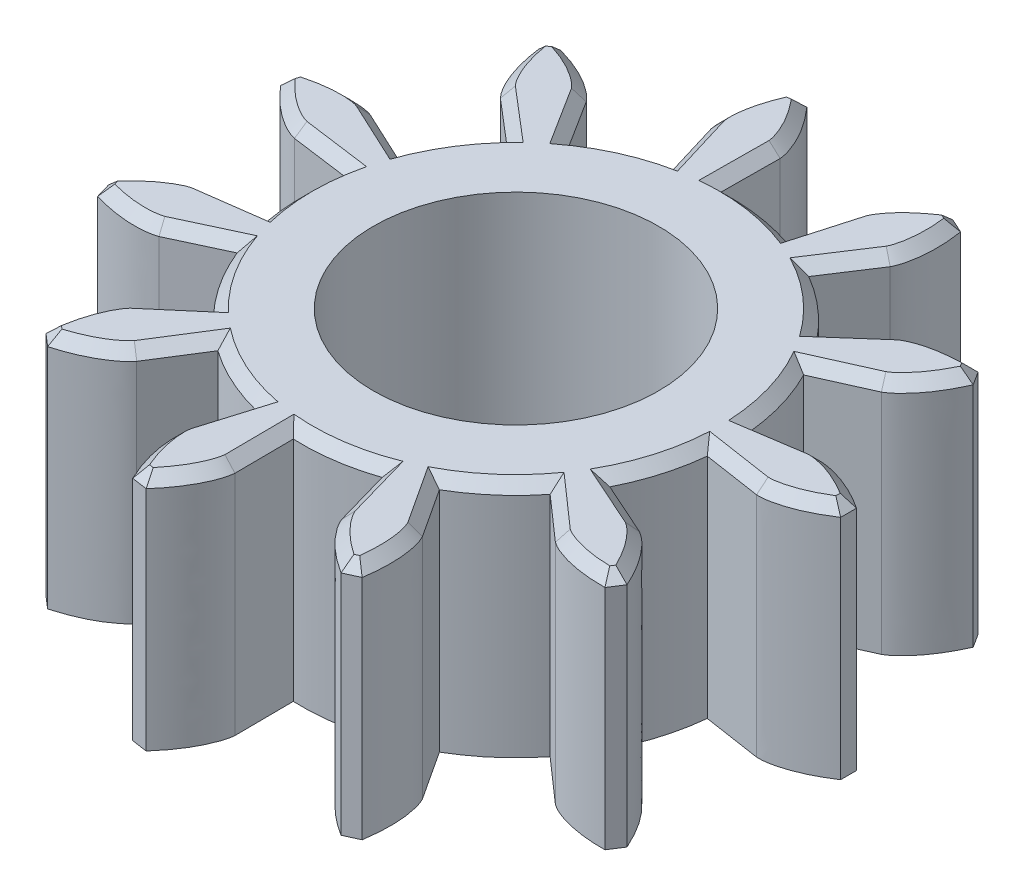
from build123d import *

# Parameters (mm, degrees)
BOSS_EXTRUDE1_DEPTH = 4.5
SKETCH2_R           = 2.7
CUT_EXTRUDE1_DEPTH  = 11.20953302
CHAMFER1_SIZE       = 0.2


with BuildPart() as part:
    # Sketch1 → Boss-Extrude1 (new body)
    with BuildSketch(Plane.XZ.offset(5)):
        with BuildLine():
            Line((3.190229537, -2.808012732), (3.879551376, -3.414747915))
            add(Edge.make_bspline(
                [(3.879551376, -3.414747915), (4.371081204, -3.768547035), (5.325327031, -3.7270487)],
                knots=[3.664389894, 3.664389894, 3.664389894, 4.719659584, 4.719659584, 4.719659584], degree=2, weights=[1, 0.864000321, 1]))
            Line((5.325327031, -3.7270487), (5.602463544, -3.295815869))
            add(Edge.make_bspline(
                [(5.602463544, -3.295815869), (5.243842932, -2.409552511), (4.717787845, -2.11042651)],
                knots=[1.542822379, 1.542822379, 1.542822379, 2.616695251, 2.616695251, 2.616695251], degree=2, weights=[1, 0.859279742, 1]))
            Line((4.717787845, -2.11042651), (3.879527469, -1.735444214))
            ThreePointArc((3.879527469, -1.735444214), (4.077845138, -1.197363367), (4.201918167, -0.637482326))
            Line((4.201918167, -0.637482326), (5.109838405, -0.775224919))
            add(Edge.make_bspline(
                [(5.109838405, -0.775224919), (5.714617855, -0.807118591), (6.494944834, -0.256303727)],
                knots=[3.664389894, 3.664389894, 3.664389894, 4.719659584, 4.719659584, 4.719659584], degree=2, weights=[1, 0.864000321, 1]))
            Line((6.494944834, -0.256303727), (6.494944834, 0.256303727))
            add(Edge.make_bspline(
                [(6.494944834, 0.256303727), (5.714103832, 0.807990967), (5.109838405, 0.775224919)],
                knots=[1.542822379, 1.542822379, 1.542822379, 2.616695251, 2.616695251, 2.616695251], degree=2, weights=[1, 0.859279742, 1]))
            Line((5.109838405, 0.775224919), (4.201918167, 0.637482326))
            ThreePointArc((4.201918167, 0.637482326), (4.077845138, 1.197363367), (3.879527469, 1.735444214))
            Line((3.879527469, 1.735444214), (4.717787845, 2.11042651))
            add(Edge.make_bspline(
                [(4.717787845, 2.11042651), (5.243803714, 2.410564302), (5.602463544, 3.295815869)],
                knots=[0.52279724, 0.52279724, 0.52279724, 1.57806693, 1.57806693, 1.57806693], degree=2, weights=[1, 0.864000321, 1]))
            Line((5.602463544, 3.295815869), (5.325327031, 3.7270487))
            add(Edge.make_bspline(
                [(5.325327031, 3.7270487), (4.370177139, 3.769003022), (3.879551376, 3.414747915)],
                knots=[1.542822379, 1.542822379, 1.542822379, 2.616695251, 2.616695251, 2.616695251], degree=2, weights=[1, 0.859279742, 1]))
            Line((3.879551376, 3.414747915), (3.190229537, 2.808012732))
            ThreePointArc((3.190229537, 2.808012732), (2.783158119, 3.211935691), (2.32541421, 3.557379478))
            Line((2.32541421, 3.557379478), (2.827872978, 4.326032434))
            add(Edge.make_bspline(
                [(2.827872978, 4.326032434), (3.108118945, 4.862910062), (2.931239663, 5.801537213)],
                knots=[0.52279724, 0.52279724, 0.52279724, 1.57806693, 1.57806693, 1.57806693], degree=2, weights=[1, 0.864000321, 1]))
            Line((2.931239663, 5.801537213), (2.464955522, 6.014482045))
            add(Edge.make_bspline(
                [(2.464955522, 6.014482045), (1.638750082, 5.533383248), (1.417534197, 4.970112574)],
                knots=[1.542822379, 1.542822379, 1.542822379, 2.616695251, 2.616695251, 2.616695251], degree=2, weights=[1, 0.859279742, 1]))
            Line((1.417534197, 4.970112574), (1.16566557, 4.087018936))
            ThreePointArc((1.16566557, 4.087018936), (0.604838063, 4.206741128), (0.032998371, 4.249871893))
            Line((0.032998371, 4.249871893), (0.040128421, 5.168153627))
            add(Edge.make_bspline(
                [(0.040128421, 5.168153627), (-0.014371628, 5.771316237), (-0.670632099, 6.465311484)],
                knots=[0.52279724, 0.52279724, 0.52279724, 1.57806693, 1.57806693, 1.57806693], degree=2, weights=[1, 0.864000321, 1]))
            Line((-0.670632099, 6.465311484), (-1.178021948, 6.392359837))
            add(Edge.make_bspline(
                [(-1.178021948, 6.392359837), (-1.612968547, 5.54095339), (-1.494540074, 4.947501609)],
                knots=[4.684415032, 4.684415032, 4.684415032, 5.758287905, 5.758287905, 5.758287905], degree=2, weights=[1, 0.859279742, 1]))
            Line((-1.494540074, 4.947501609), (-1.22898898, 4.068425505))
            ThreePointArc((-1.22898898, 4.068425505), (-1.765513805, 3.86593598), (-2.269894218, 3.59306001))
            Line((-2.269894218, 3.59306001), (-2.760356625, 4.369422559))
            add(Edge.make_bspline(
                [(-2.760356625, 4.369422559), (-3.132299311, 4.847370285), (-4.059582909, 5.076395041)],
                knots=[0.52279724, 0.52279724, 0.52279724, 1.57806693, 1.57806693, 1.57806693], degree=2, weights=[1, 0.864000321, 1]))
            Line((-4.059582909, 5.076395041), (-4.446985774, 4.740708547))
            add(Edge.make_bspline(
                [(-4.446985774, 4.740708547), (-4.352581058, 3.789309981), (-3.932108431, 3.35409384)],
                knots=[4.684415032, 4.684415032, 4.684415032, 5.758287905, 5.758287905, 5.758287905], degree=2, weights=[1, 0.859279742, 1]))
            Line((-3.932108431, 3.35409384), (-3.233448212, 2.758135722))
            ThreePointArc((-3.233448212, 2.758135722), (-3.575327515, 2.297723474), (-3.852111431, 1.795476962))
            Line((-3.852111431, 1.795476962), (-4.684447947, 2.183430702))
            add(Edge.make_bspline(
                [(-4.684447947, 2.183430702), (-5.255744094, 2.384418517), (-6.159644828, 2.07575904)],
                knots=[0.52279724, 0.52279724, 0.52279724, 1.57806693, 1.57806693, 1.57806693], degree=2, weights=[1, 0.864000321, 1]))
            Line((-6.159644828, 2.07575904), (-6.304063037, 1.58391579))
            add(Edge.make_bspline(
                [(-6.304063037, 1.58391579), (-5.710279838, 0.834587427), (-5.121260145, 0.695784976)],
                knots=[4.684415032, 4.684415032, 4.684415032, 5.758287905, 5.758287905, 5.758287905], degree=2, weights=[1, 0.859279742, 1]))
            Line((-5.121260145, 0.695784976), (-4.211310483, 0.572157336))
            ThreePointArc((-4.211310483, 0.572157336), (-4.25, 0), (-4.211310483, -0.572157336))
            Line((-4.211310483, -0.572157336), (-5.121260145, -0.695784976))
            add(Edge.make_bspline(
                [(-5.121260145, -0.695784976), (-5.710527263, -0.835569283), (-6.304063037, -1.58391579)],
                knots=[3.664389894, 3.664389894, 3.664389894, 4.719659584, 4.719659584, 4.719659584], degree=2, weights=[1, 0.864000321, 1]))
            Line((-6.304063037, -1.58391579), (-6.159644828, -2.07575904))
            add(Edge.make_bspline(
                [(-6.159644828, -2.07575904), (-5.255005116, -2.385110738), (-4.684447947, -2.183430702)],
                knots=[4.684415032, 4.684415032, 4.684415032, 5.758287905, 5.758287905, 5.758287905], degree=2, weights=[1, 0.859279742, 1]))
            Line((-4.684447947, -2.183430702), (-3.852111431, -1.795476962))
            ThreePointArc((-3.852111431, -1.795476962), (-3.575327515, -2.297723474), (-3.233448212, -2.758135722))
            Line((-3.233448212, -2.758135722), (-3.932108431, -3.35409384))
            add(Edge.make_bspline(
                [(-3.932108431, -3.35409384), (-4.352258375, -3.790269739), (-4.446985774, -4.740708547)],
                knots=[3.664389894, 3.664389894, 3.664389894, 4.719659584, 4.719659584, 4.719659584], degree=2, weights=[1, 0.864000321, 1]))
            Line((-4.446985774, -4.740708547), (-4.059582909, -5.076395041))
            add(Edge.make_bspline(
                [(-4.059582909, -5.076395041), (-3.1313034, -4.847553096), (-2.760356625, -4.369422559)],
                knots=[4.684415032, 4.684415032, 4.684415032, 5.758287905, 5.758287905, 5.758287905], degree=2, weights=[1, 0.859279742, 1]))
            Line((-2.760356625, -4.369422559), (-2.269894218, -3.59306001))
            ThreePointArc((-2.269894218, -3.59306001), (-1.765513805, -3.86593598), (-1.22898898, -4.068425505))
            Line((-1.22898898, -4.068425505), (-1.494540074, -4.947501609))
            add(Edge.make_bspline(
                [(-1.494540074, -4.947501609), (-1.612178204, -5.541586333), (-1.178021948, -6.392359837)],
                knots=[3.664389894, 3.664389894, 3.664389894, 4.719659584, 4.719659584, 4.719659584], degree=2, weights=[1, 0.864000321, 1]))
            Line((-1.178021948, -6.392359837), (-0.670632099, -6.465311484))
            add(Edge.make_bspline(
                [(-0.670632099, -6.465311484), (-0.013434979, -5.770931598), (0.040128421, -5.168153627)],
                knots=[1.542822379, 1.542822379, 1.542822379, 2.616695251, 2.616695251, 2.616695251], degree=2, weights=[1, 0.859279742, 1]))
            Line((0.040128421, -5.168153627), (0.032998371, -4.249871893))
            ThreePointArc((0.032998371, -4.249871893), (0.604838063, -4.206741128), (1.16566557, -4.087018936))
            Line((1.16566557, -4.087018936), (1.417534197, -4.970112574))
            add(Edge.make_bspline(
                [(1.417534197, -4.970112574), (1.639757156, -5.533488422), (2.464955522, -6.014482045)],
                knots=[3.664389894, 3.664389894, 3.664389894, 4.719659584, 4.719659584, 4.719659584], degree=2, weights=[1, 0.864000321, 1]))
            Line((2.464955522, -6.014482045), (2.931239663, -5.801537213))
            add(Edge.make_bspline(
                [(2.931239663, -5.801537213), (3.108698953, -4.862080092), (2.827872978, -4.326032434)],
                knots=[1.542822379, 1.542822379, 1.542822379, 2.616695251, 2.616695251, 2.616695251], degree=2, weights=[1, 0.859279742, 1]))
            Line((2.827872978, -4.326032434), (2.32541421, -3.557379478))
            ThreePointArc((2.32541421, -3.557379478), (2.783158119, -3.211935691), (3.190229537, -2.808012732))
        make_face()
    extrude(amount=-BOSS_EXTRUDE1_DEPTH)

    # Sketch2 → Cut-Extrude1 (cut, through all)
    # profile 1 of 2: a face of its own
    with BuildSketch(Plane(origin=(0, -0.5, 0), x_dir=(1, 0, 0), z_dir=(0, 1, 0))):
        with BuildLine():
            Line((2.32541421, 3.557379478), (2.827872978, 4.326032434))
            add(Edge.make_bspline(
                [(2.827872978, 4.326032434), (3.108698953, 4.862080092), (2.931239663, 5.801537213)],
                knots=[3.666490056, 3.666490056, 3.666490056, 4.740362929, 4.740362929, 4.740362929], degree=2, weights=[1, 0.859279742, 1]))
            Line((2.931239663, 5.801537213), (2.464955522, 6.014482045))
            add(Edge.make_bspline(
                [(2.464955522, 6.014482045), (1.639757156, 5.533488422), (1.417534197, 4.970112574)],
                knots=[1.563525724, 1.563525724, 1.563525724, 2.618795414, 2.618795414, 2.618795414], degree=2, weights=[1, 0.864000321, 1]))
            Line((1.417534197, 4.970112574), (1.16566557, 4.087018936))
            ThreePointArc((1.16566557, 4.087018936), (0.604838063, 4.206741128), (0.032998371, 4.249871893))
            Line((0.032998371, 4.249871893), (0.040128421, 5.168153627))
            add(Edge.make_bspline(
                [(0.040128421, 5.168153627), (-0.013434979, 5.770931598), (-0.670632099, 6.465311484)],
                knots=[3.666490056, 3.666490056, 3.666490056, 4.740362929, 4.740362929, 4.740362929], degree=2, weights=[1, 0.859279742, 1]))
            Line((-0.670632099, 6.465311484), (-1.178021948, 6.392359837))
            add(Edge.make_bspline(
                [(-1.178021948, 6.392359837), (-1.612178204, 5.541586333), (-1.494540074, 4.947501609)],
                knots=[1.563525724, 1.563525724, 1.563525724, 2.618795414, 2.618795414, 2.618795414], degree=2, weights=[1, 0.864000321, 1]))
            Line((-1.494540074, 4.947501609), (-1.22898898, 4.068425505))
            ThreePointArc((-1.22898898, 4.068425505), (-1.765513805, 3.86593598), (-2.269894218, 3.59306001))
            Line((-2.269894218, 3.59306001), (-2.760356625, 4.369422559))
            add(Edge.make_bspline(
                [(-2.760356625, 4.369422559), (-3.1313034, 4.847553096), (-4.059582909, 5.076395041)],
                knots=[0.524897402, 0.524897402, 0.524897402, 1.598770275, 1.598770275, 1.598770275], degree=2, weights=[1, 0.859279742, 1]))
            Line((-4.059582909, 5.076395041), (-4.446985774, 4.740708547))
            add(Edge.make_bspline(
                [(-4.446985774, 4.740708547), (-4.352258375, 3.790269739), (-3.932108431, 3.35409384)],
                knots=[1.563525724, 1.563525724, 1.563525724, 2.618795414, 2.618795414, 2.618795414], degree=2, weights=[1, 0.864000321, 1]))
            Line((-3.932108431, 3.35409384), (-3.233448212, 2.758135722))
            ThreePointArc((-3.233448212, 2.758135722), (-3.575327515, 2.297723474), (-3.852111431, 1.795476962))
            Line((-3.852111431, 1.795476962), (-4.684447947, 2.183430702))
            add(Edge.make_bspline(
                [(-4.684447947, 2.183430702), (-5.255005116, 2.385110738), (-6.159644828, 2.07575904)],
                knots=[0.524897402, 0.524897402, 0.524897402, 1.598770275, 1.598770275, 1.598770275], degree=2, weights=[1, 0.859279742, 1]))
            Line((-6.159644828, 2.07575904), (-6.304063037, 1.58391579))
            add(Edge.make_bspline(
                [(-6.304063037, 1.58391579), (-5.710527263, 0.835569283), (-5.121260145, 0.695784976)],
                knots=[1.563525724, 1.563525724, 1.563525724, 2.618795414, 2.618795414, 2.618795414], degree=2, weights=[1, 0.864000321, 1]))
            Line((-5.121260145, 0.695784976), (-4.211310483, 0.572157336))
            ThreePointArc((-4.211310483, 0.572157336), (-4.25, 0), (-4.211310483, -0.572157336))
            Line((-4.211310483, -0.572157336), (-5.121260145, -0.695784976))
            add(Edge.make_bspline(
                [(-5.121260145, -0.695784976), (-5.710279838, -0.834587427), (-6.304063037, -1.58391579)],
                knots=[0.524897402, 0.524897402, 0.524897402, 1.598770275, 1.598770275, 1.598770275], degree=2, weights=[1, 0.859279742, 1]))
            Line((-6.304063037, -1.58391579), (-6.159644828, -2.07575904))
            add(Edge.make_bspline(
                [(-6.159644828, -2.07575904), (-5.255744094, -2.384418517), (-4.684447947, -2.183430702)],
                knots=[4.705118377, 4.705118377, 4.705118377, 5.760388067, 5.760388067, 5.760388067], degree=2, weights=[1, 0.864000321, 1]))
            Line((-4.684447947, -2.183430702), (-3.852111431, -1.795476962))
            ThreePointArc((-3.852111431, -1.795476962), (-3.575327515, -2.297723474), (-3.233448212, -2.758135722))
            Line((-3.233448212, -2.758135722), (-3.932108431, -3.35409384))
            add(Edge.make_bspline(
                [(-3.932108431, -3.35409384), (-4.352581058, -3.789309981), (-4.446985774, -4.740708547)],
                knots=[0.524897402, 0.524897402, 0.524897402, 1.598770275, 1.598770275, 1.598770275], degree=2, weights=[1, 0.859279742, 1]))
            Line((-4.446985774, -4.740708547), (-4.059582909, -5.076395041))
            add(Edge.make_bspline(
                [(-4.059582909, -5.076395041), (-3.132299311, -4.847370285), (-2.760356625, -4.369422559)],
                knots=[4.705118377, 4.705118377, 4.705118377, 5.760388067, 5.760388067, 5.760388067], degree=2, weights=[1, 0.864000321, 1]))
            Line((-2.760356625, -4.369422559), (-2.269894218, -3.59306001))
            ThreePointArc((-2.269894218, -3.59306001), (-1.765513805, -3.86593598), (-1.22898898, -4.068425505))
            Line((-1.22898898, -4.068425505), (-1.494540074, -4.947501609))
            add(Edge.make_bspline(
                [(-1.494540074, -4.947501609), (-1.612968547, -5.54095339), (-1.178021948, -6.392359837)],
                knots=[0.524897402, 0.524897402, 0.524897402, 1.598770275, 1.598770275, 1.598770275], degree=2, weights=[1, 0.859279742, 1]))
            Line((-1.178021948, -6.392359837), (-0.670632099, -6.465311484))
            add(Edge.make_bspline(
                [(-0.670632099, -6.465311484), (-0.014371628, -5.771316237), (0.040128421, -5.168153627)],
                knots=[4.705118377, 4.705118377, 4.705118377, 5.760388067, 5.760388067, 5.760388067], degree=2, weights=[1, 0.864000321, 1]))
            Line((0.040128421, -5.168153627), (0.032998371, -4.249871893))
            ThreePointArc((0.032998371, -4.249871893), (0.604838063, -4.206741128), (1.16566557, -4.087018936))
            Line((1.16566557, -4.087018936), (1.417534197, -4.970112574))
            add(Edge.make_bspline(
                [(1.417534197, -4.970112574), (1.638750082, -5.533383248), (2.464955522, -6.014482045)],
                knots=[3.666490056, 3.666490056, 3.666490056, 4.740362929, 4.740362929, 4.740362929], degree=2, weights=[1, 0.859279742, 1]))
            Line((2.464955522, -6.014482045), (2.931239663, -5.801537213))
            add(Edge.make_bspline(
                [(2.931239663, -5.801537213), (3.108118945, -4.862910062), (2.827872978, -4.326032434)],
                knots=[4.705118377, 4.705118377, 4.705118377, 5.760388067, 5.760388067, 5.760388067], degree=2, weights=[1, 0.864000321, 1]))
            Line((2.827872978, -4.326032434), (2.32541421, -3.557379478))
            ThreePointArc((2.32541421, -3.557379478), (2.783158119, -3.211935691), (3.190229537, -2.808012732))
            Line((3.190229537, -2.808012732), (3.879551376, -3.414747915))
            add(Edge.make_bspline(
                [(3.879551376, -3.414747915), (4.370177139, -3.769003022), (5.325327031, -3.7270487)],
                knots=[0.524897402, 0.524897402, 0.524897402, 1.598770275, 1.598770275, 1.598770275], degree=2, weights=[1, 0.859279742, 1]))
            Line((5.325327031, -3.7270487), (5.602463544, -3.295815869))
            add(Edge.make_bspline(
                [(5.602463544, -3.295815869), (5.243803714, -2.410564302), (4.717787845, -2.11042651)],
                knots=[4.705118377, 4.705118377, 4.705118377, 5.760388067, 5.760388067, 5.760388067], degree=2, weights=[1, 0.864000321, 1]))
            Line((4.717787845, -2.11042651), (3.879527469, -1.735444214))
            ThreePointArc((3.879527469, -1.735444214), (4.077845138, -1.197363367), (4.201918167, -0.637482326))
            Line((4.201918167, -0.637482326), (5.109838405, -0.775224919))
            add(Edge.make_bspline(
                [(5.109838405, -0.775224919), (5.714103832, -0.807990967), (6.494944834, -0.256303727)],
                knots=[0.524897402, 0.524897402, 0.524897402, 1.598770275, 1.598770275, 1.598770275], degree=2, weights=[1, 0.859279742, 1]))
            Line((6.494944834, -0.256303727), (6.494944834, 0.256303727))
            add(Edge.make_bspline(
                [(6.494944834, 0.256303727), (5.714617855, 0.807118591), (5.109838405, 0.775224919)],
                knots=[1.563525724, 1.563525724, 1.563525724, 2.618795414, 2.618795414, 2.618795414], degree=2, weights=[1, 0.864000321, 1]))
            Line((5.109838405, 0.775224919), (4.201918167, 0.637482326))
            ThreePointArc((4.201918167, 0.637482326), (4.077845138, 1.197363367), (3.879527469, 1.735444214))
            Line((3.879527469, 1.735444214), (4.717787845, 2.11042651))
            add(Edge.make_bspline(
                [(4.717787845, 2.11042651), (5.243842932, 2.409552511), (5.602463544, 3.295815869)],
                knots=[3.666490056, 3.666490056, 3.666490056, 4.740362929, 4.740362929, 4.740362929], degree=2, weights=[1, 0.859279742, 1]))
            Line((5.602463544, 3.295815869), (5.325327031, 3.7270487))
            add(Edge.make_bspline(
                [(5.325327031, 3.7270487), (4.371081204, 3.768547035), (3.879551376, 3.414747915)],
                knots=[4.705118377, 4.705118377, 4.705118377, 5.760388067, 5.760388067, 5.760388067], degree=2, weights=[1, 0.864000321, 1]))
            Line((3.879551376, 3.414747915), (3.190229537, 2.808012732))
            ThreePointArc((3.190229537, 2.808012732), (2.783158119, 3.211935691), (2.32541421, 3.557379478))
        make_face()
        with BuildLine():
            Line((-0.168586831, 4.046489649), (-0.159945043, 5.159468612))
            add(Edge.make_bspline(
                [(-0.159945043, 5.159468612), (-0.167931869, 5.23818369), (-0.200970585, 5.377796799), (-0.323414772, 5.665197706), (-0.506370611, 5.961153156), (-0.664182667, 6.159858015), (-0.746565057, 6.252337328)],
                knots=[-2.605383067, -2.605383067, -2.605383067, -2.605383067, -2.356634464, -2.107885861, -1.859137258, -1.610388655, -1.610388655, -1.610388655, -1.610388655], degree=3))
            Line((-0.746565057, 6.252337328), (-1.045125524, 6.209410813))
            add(Edge.make_bspline(
                [(-1.045125524, 6.209410813), (-1.098126927, 6.097397421), (-1.193728575, 5.86197242), (-1.285687853, 5.527188917), (-1.322197169, 5.217563223), (-1.314531622, 5.073456654), (-1.300081514, 4.995394501)],
                knots=[1.629776697, 1.629776697, 1.629776697, 1.629776697, 1.874230759, 2.11868482, 2.363138882, 2.607592943, 2.607592943, 2.607592943, 2.607592943], degree=3))
            Line((-1.300081514, 4.995394501), (-0.978269995, 3.930074785))
            ThreePointArc((-0.978269995, 3.930074785), (-1.682430803, 3.684009581), (-2.329521739, 3.312978791))
            Line((-2.329521739, 3.312978791), (-2.92397366, 4.253948379))
            add(Edge.make_bspline(
                [(-2.92397366, 4.253948379), (-2.973249191, 4.315849712), (-3.076523672, 4.415437654), (-3.334910939, 4.591016357), (-3.648828781, 4.741076531), (-3.889016688, 4.822918056), (-4.008319255, 4.856177323)],
                knots=[0.536209586, 0.536209586, 0.536209586, 0.536209586, 0.784958189, 1.033706792, 1.282455395, 1.531203998, 1.531203998, 1.531203998, 1.531203998], degree=3))
            Line((-4.008319255, 4.856177323), (-4.236276477, 4.658651266))
            add(Edge.make_bspline(
                [(-4.236276477, 4.658651266), (-4.220305083, 4.535764882), (-4.173449942, 4.286026615), (-4.069813382, 3.954671872), (-3.933130686, 3.674459735), (-3.848772124, 3.557373883), (-3.794412334, 3.499516139)],
                knots=[1.629776697, 1.629776697, 1.629776697, 1.629776697, 1.874230759, 2.11868482, 2.363138882, 2.607592943, 2.607592943, 2.607592943, 2.607592943], degree=3))
            Line((-3.794412334, 3.499516139), (-2.947731934, 2.777296607))
            ThreePointArc((-2.947731934, 2.777296607), (-3.407076808, 2.189595311), (-3.750849954, 1.527620575))
            Line((-3.750849954, 1.527620575), (-4.759661301, 1.997829592))
            add(Edge.make_bspline(
                [(-4.759661301, 1.997829592), (-4.834580902, 2.023263944), (-4.975302231, 2.051208253), (-5.287596445, 2.059219754), (-5.632809594, 2.015741606), (-5.879115388, 1.954735692), (-5.997460412, 1.91821533)],
                knots=[0.536209586, 0.536209586, 0.536209586, 0.536209586, 0.784958189, 1.033706792, 1.282455395, 1.531203998, 1.531203998, 1.531203998, 1.531203998], degree=3))
            Line((-5.997460412, 1.91821533), (-6.082439581, 1.628802858))
            add(Edge.make_bspline(
                [(-6.082439581, 1.628802858), (-6.002566194, 1.534059041), (-5.828130441, 1.349297644), (-5.561801919, 1.126574449), (-5.295322999, 0.964741244), (-5.161054671, 0.91185004), (-5.084044047, 0.89256613)],
                knots=[1.629776697, 1.629776697, 1.629776697, 1.629776697, 1.874230759, 2.11868482, 2.363138882, 2.607592943, 2.607592943, 2.607592943, 2.607592943], degree=3))
            Line((-5.084044047, 0.89256613), (-3.981309811, 0.74274638))
            ThreePointArc((-3.981309811, 0.74274638), (-4.05, 0), (-3.981309811, -0.74274638))
            Line((-3.981309811, -0.74274638), (-5.084190108, -0.892585974))
            add(Edge.make_bspline(
                [(-5.084190108, -0.892585974), (-5.160967336, -0.91169383), (-5.294457485, -0.964265276), (-5.561507441, -1.126364572), (-5.828413161, -1.349577036), (-6.002636493, -1.534061443), (-6.082450264, -1.628766477)],
                knots=[0.536209586, 0.536209586, 0.536209586, 0.536209586, 0.784958189, 1.033706792, 1.282455395, 1.531203998, 1.531203998, 1.531203998, 1.531203998], degree=3))
            Line((-6.082450264, -1.628766477), (-5.997471094, -1.918178948))
            add(Edge.make_bspline(
                [(-5.997471094, -1.918178948), (-5.879054951, -1.954699706), (-5.632420704, -2.015823796), (-5.287957645, -2.059202401), (-4.976287676, -2.051275775), (-4.834738826, -2.023179749), (-4.759527698, -1.99776732)],
                knots=[-1.511815956, -1.511815956, -1.511815956, -1.511815956, -1.267361895, -1.022907833, -0.778453772, -0.53399971, -0.53399971, -0.53399971, -0.53399971], degree=3))
            Line((-4.759527698, -1.99776732), (-3.750849954, -1.527620575))
            ThreePointArc((-3.750849954, -1.527620575), (-3.407076808, -2.189595311), (-2.947731934, -2.777296607))
            Line((-2.947731934, -2.777296607), (-3.794524479, -3.4996118))
            add(Edge.make_bspline(
                [(-3.794524479, -3.4996118), (-3.848783107, -3.557195255), (-3.932659897, -3.673591393), (-4.06967912, -3.954336104), (-4.17353673, -4.286414505), (-4.220362924, -4.535804909), (-4.236305133, -4.658626435)],
                knots=[0.536209586, 0.536209586, 0.536209586, 0.536209586, 0.784958189, 1.033706792, 1.282455395, 1.531203998, 1.531203998, 1.531203998, 1.531203998], degree=3))
            Line((-4.236305133, -4.658626435), (-4.008347912, -4.856152492))
            add(Edge.make_bspline(
                [(-4.008347912, -4.856152492), (-3.8889853, -4.822855108), (-3.648457191, -4.740935424), (-3.335224181, -4.591197038), (-3.077316176, -4.416027229), (-2.973427564, -4.315864262), (-2.923894933, -4.253823761)],
                knots=[-1.511815956, -1.511815956, -1.511815956, -1.511815956, -1.267361895, -1.022907833, -0.778453772, -0.53399971, -0.53399971, -0.53399971, -0.53399971], degree=3))
            Line((-2.923894933, -4.253823761), (-2.329521739, -3.312978791))
            ThreePointArc((-2.329521739, -3.312978791), (-1.682430803, -3.684009581), (-0.978269995, -3.930074785))
            Line((-0.978269995, -3.930074785), (-1.300124139, -4.995535607))
            add(Edge.make_bspline(
                [(-1.300124139, -4.995535607), (-1.314637435, -5.07331232), (-1.322270578, -5.216578199), (-1.285756433, -5.526833864), (-1.193591877, -5.862345655), (-1.098153946, -6.097462365), (-1.045163055, -6.209405417)],
                knots=[0.536209586, 0.536209586, 0.536209586, 0.536209586, 0.784958189, 1.033706792, 1.282455395, 1.531203998, 1.531203998, 1.531203998, 1.531203998], degree=3))
            Line((-1.045163055, -6.209405417), (-0.746602588, -6.252331932))
            add(Edge.make_bspline(
                [(-0.746602588, -6.252331932), (-0.664190295, -6.159788089), (-0.506134298, -5.960833552), (-0.323580605, -5.665519056), (-0.201318533, -5.378721241), (-0.16807406, -5.238292367), (-0.159946187, -5.159321214)],
                knots=[-1.511815956, -1.511815956, -1.511815956, -1.511815956, -1.267361895, -1.022907833, -0.778453772, -0.53399971, -0.53399971, -0.53399971, -0.53399971], degree=3))
            Line((-0.159946187, -5.159321214), (-0.168586831, -4.046489649))
            ThreePointArc((-0.168586831, -4.046489649), (0.576375095, -4.00877684), (1.301785755, -3.835081987))
            Line((1.301785755, -3.835081987), (1.607056429, -4.905412155))
            add(Edge.make_bspline(
                [(1.607056429, -4.905412155), (1.636896333, -4.97868857), (1.707930306, -5.103338285), (1.906384836, -5.344600922), (2.165309964, -5.577023481), (2.372711151, -5.723218602), (2.477810908, -5.788742052)],
                knots=[-2.605383067, -2.605383067, -2.605383067, -2.605383067, -2.356634464, -2.107885861, -1.859137258, -1.610388655, -1.610388655, -1.610388655, -1.610388655], degree=3))
            Line((2.477810908, -5.788742052), (2.752183781, -5.66344016))
            add(Edge.make_bspline(
                [(2.752183781, -5.66344016), (2.771480436, -5.541031876), (2.796882658, -5.288209145), (2.790797527, -4.941078804), (2.738596321, -4.633709262), (2.69064177, -4.497599657), (2.654784343, -4.426770635)],
                knots=[-1.511815956, -1.511815956, -1.511815956, -1.511815956, -1.267361895, -1.022907833, -0.778453772, -0.53399971, -0.53399971, -0.53399971, -0.53399971], degree=3))
            Line((2.654784343, -4.426770635), (2.045873205, -3.495268635))
            ThreePointArc((2.045873205, -3.495268635), (2.652185972, -3.060785776), (3.168533726, -2.522477756))
            Line((3.168533726, -2.522477756), (4.004007936, -3.257855004))
            add(Edge.make_bspline(
                [(4.004007936, -3.257855004), (4.068727081, -3.303366377), (4.195875386, -3.369824525), (4.49326239, -3.465494951), (4.836741191, -3.521035757), (5.090257222, -3.531893372), (5.214097415, -3.530193987)],
                knots=[-2.605383067, -2.605383067, -2.605383067, -2.605383067, -2.356634464, -2.107885861, -1.859137258, -1.610388655, -1.610388655, -1.610388655, -1.610388655], degree=3))
            Line((5.214097415, -3.530193987), (5.377171247, -3.276446153))
            add(Edge.make_bspline(
                [(5.377171247, -3.276446153), (5.327225711, -3.163037192), (5.211909132, -2.936615699), (5.019117162, -2.647880944), (4.809026194, -2.417527333), (4.69509785, -2.328950834), (4.626639603, -2.288751658)],
                knots=[-1.511815956, -1.511815956, -1.511815956, -1.511815956, -1.267361895, -1.022907833, -0.778453772, -0.53399971, -0.53399971, -0.53399971, -0.53399971], degree=3))
            Line((4.626639603, -2.288751658), (3.610782953, -1.834324526))
            ThreePointArc((3.610782953, -1.834324526), (3.885946543, -1.141016855), (4.029294627, -0.40900466))
            Line((4.029294627, -0.40900466), (5.129715214, -0.575951908))
            add(Edge.make_bspline(
                [(5.129715214, -0.575951908), (5.20876573, -0.579248699), (5.351659678, -0.566415287), (5.653560883, -0.486118819), (5.972541264, -0.347144059), (6.191682591, -0.219216952), (6.294944834, -0.150834275)],
                knots=[-2.605383067, -2.605383067, -2.605383067, -2.605383067, -2.356634464, -2.107885861, -1.859137258, -1.610388655, -1.610388655, -1.610388655, -1.610388655], degree=3))
            Line((6.294944834, -0.150834275), (6.294944834, 0.150796357))
            add(Edge.make_bspline(
                [(6.294944834, 0.150796357), (6.191614463, 0.21919945), (5.972191282, 0.347332482), (5.653902562, 0.486000407), (5.352624229, 0.566202443), (5.208893536, 0.579123422), (5.129569478, 0.575929798)],
                knots=[1.629776697, 1.629776697, 1.629776697, 1.629776697, 1.874230759, 2.11868482, 2.363138882, 2.607592943, 2.607592943, 2.607592943, 2.607592943], degree=3))
            Line((5.129569478, 0.575929798), (4.029294627, 0.40900466))
            ThreePointArc((4.029294627, 0.40900466), (3.885946543, 1.141016855), (3.610782953, 1.834324526))
            Line((3.610782953, 1.834324526), (4.626774157, 2.288811849))
            add(Edge.make_bspline(
                [(4.626774157, 2.288811849), (4.695058062, 2.328776347), (4.808329834, 2.416826801), (5.018893741, 2.647596603), (5.212101686, 2.936963425), (5.327292486, 3.163059302), (5.377191746, 3.276414255)],
                knots=[-2.605383067, -2.605383067, -2.605383067, -2.605383067, -2.356634464, -2.107885861, -1.859137258, -1.610388655, -1.610388655, -1.610388655, -1.610388655], degree=3))
            Line((5.377191746, 3.276414255), (5.214117915, 3.530162089))
            add(Edge.make_bspline(
                [(5.214117915, 3.530162089), (5.090209371, 3.531841817), (4.836344898, 3.521005055), (4.493613847, 3.465580063), (4.196801891, 3.370166944), (4.068902329, 3.303330085), (4.003897289, 3.257757614)],
                knots=[1.629776697, 1.629776697, 1.629776697, 1.629776697, 1.874230759, 2.11868482, 2.363138882, 2.607592943, 2.607592943, 2.607592943, 2.607592943], degree=3))
            Line((4.003897289, 3.257757614), (3.168533726, 2.522477756))
            ThreePointArc((3.168533726, 2.522477756), (2.652185972, 3.060785776), (2.045873205, 3.495268635))
            Line((2.045873205, 3.495268635), (2.654864996, 4.426894016))
            add(Edge.make_bspline(
                [(2.654864996, 4.426894016), (2.690702634, 4.497431358), (2.738389243, 4.632743457), (2.790763299, 4.940718811), (2.79685665, 5.288605774), (2.771524657, 5.541086577), (2.752218272, 5.663424408)],
                knots=[-2.605383067, -2.605383067, -2.605383067, -2.605383067, -2.356634464, -2.107885861, -1.859137258, -1.610388655, -1.610388655, -1.610388655, -1.610388655], degree=3))
            Line((2.752218272, 5.663424408), (2.477845399, 5.788726301))
            add(Edge.make_bspline(
                [(2.477845399, 5.788726301), (2.372698769, 5.723149361), (2.16499318, 5.5767834), (1.906634486, 5.344862535), (1.708524606, 5.104127252), (1.637063382, 4.978752785), (1.607016, 4.905270405)],
                knots=[1.629776697, 1.629776697, 1.629776697, 1.629776697, 1.874230759, 2.11868482, 2.363138882, 2.607592943, 2.607592943, 2.607592943, 2.607592943], degree=3))
            Line((1.607016, 4.905270405), (1.301785755, 3.835081987))
            ThreePointArc((1.301785755, 3.835081987), (0.576375095, 4.00877684), (-0.168586831, 4.046489649))
        make_face(mode=Mode.SUBTRACT)
    # profile 2 of 2: a face of its own
    with BuildSketch(Plane(origin=(0, -0.5, 0), x_dir=(1, 0, 0), z_dir=(0, 1, 0))):
        with Locations(Location((0, 0, 0), (0, 0, 270))):
            Circle(SKETCH2_R)
    extrude(amount=-CUT_EXTRUDE1_DEPTH, mode=Mode.SUBTRACT)

    # Chamfer1
    chamfer1_edges = [part.edges().sort_by_distance(p)[0] for p in [
        (1.979928139, -0.5, -5.406348131),
        (1.454400877, -0.5, -4.370176196),
        (0.576375095, -0.5, -4.00877684),
        (-0.164265937, -0.5, -4.602979131),
        (-0.376640287, -0.5, -5.745193251),
        (-0.89584529, -0.5, -6.23087407),
        (-1.257270931, -0.5, -5.618539432),
        (-1.139175755, -0.5, -4.462734643),
        (-1.682430803, -0.5, -3.684009581),
        (-2.6267477, -0.5, -3.783463585),
        (-3.422935948, -0.5, -4.629537006),
        (-4.122297866, -0.5, -4.757414294),
        (-4.095295364, -0.5, -4.046884163),
        (-3.371072134, -0.5, -3.138406373),
        (-3.407076808, -0.5, -2.189595311),
        (-4.255255627, -0.5, -1.762725084),
        (-5.38247363, -0.5, -2.044035473),
        (-6.039949996, -0.5, -1.773509094),
        (-5.633092455, -0.5, -1.190371766),
        (-4.532676929, -0.5, -0.817656255),
        (-4.05, -0.5, 0),
        (-4.53274996, -0.5, 0.817666177),
        (-5.633113966, -0.5, 1.190432881),
        (-6.039960679, -0.5, 1.773472713),
        (-5.382422493, -0.5, 2.044075256),
        (-4.255188826, -0.5, 1.762693947),
        (-3.407076808, -0.5, 2.189595311),
        (-3.371128207, -0.5, 3.138454204),
        (-4.095280419, -0.5, 4.046947206),
        (-4.122326522, -0.5, 4.757389464),
        (-3.42287142, -0.5, 4.629542827),
        (-2.626708336, -0.5, 3.783401276),
        (-1.682430803, -0.5, 3.684009581),
        (-1.139197067, -0.5, 4.462805196),
        (-1.257224275, -0.5, 5.618584387),
        (-0.895882822, -0.5, 6.230868674),
        (-0.376582856, -0.5, 5.745163261),
        (-0.164266509, -0.5, 4.602905431),
        (0.576375095, -0.5, 4.00877684),
        (1.454421092, -0.5, 4.370247071),
        (1.979991693, -0.5, 5.406360725),
        (2.614997345, -0.5, 5.726091106),
        (2.789268104, -0.5, 5.036734953),
        (2.350328774, -0.5, 3.961019635),
        (2.652185972, -0.5, 3.060785776),
        (3.586270831, -0.5, 2.89016638),
        (4.588574289, -0.5, 3.477655732),
        (5.295634331, -0.5, 3.40332007),
        (5.069546149, -0.5, 2.729178885),
        (4.118711278, -0.5, 2.061538092),
        (3.885946543, -0.5, 1.141016855),
        (4.57950492, -0.5, 0.492478284),
        (5.740316969, -0.5, 0.444819616),
        (6.294944834, -0.5, 1.8959e-05),
        (5.740279111, -0.5, -0.444872195),
        (4.579432053, -0.5, -0.492467229),
        (3.885946543, -0.5, -1.141016855),
        (4.118778555, -0.5, -2.061568187),
        (5.069549571, -0.5, -2.729243585),
        (5.295654831, -0.5, -3.403288172),
        (4.588514014, -0.5, -3.477679497),
        (3.586215507, -0.5, -2.890117685),
        (2.652185972, -0.5, -3.060785776),
        (2.3503691, -0.5, -3.961081326),
        (2.789236003, -0.5, -5.036791232),
        (2.615031836, -0.5, -5.726075354),
    ]]
    chamfer(chamfer1_edges, length=CHAMFER1_SIZE)


solid = part.part
